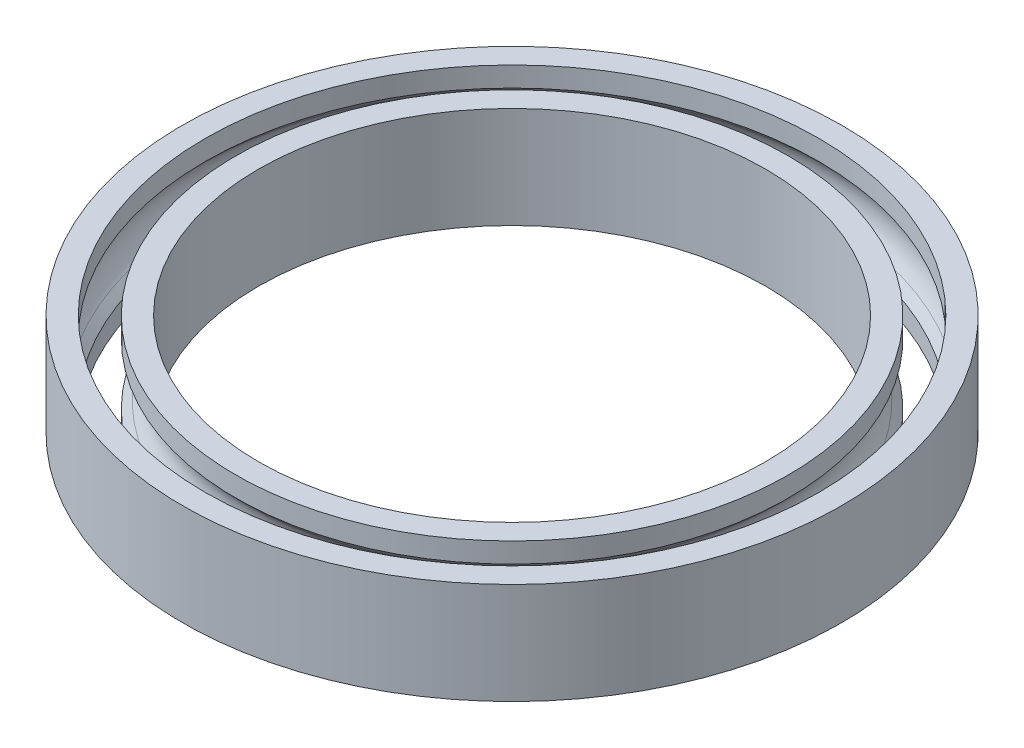
from build123d import *
from build123d.topology import SkipClean


with BuildPart() as part:
    # Sketch2 → Revolve1 (revolve)
    with BuildSketch(Plane.XY, mode=Mode.PRIVATE) as revolve1_sk:
        with BuildLine():
            Line((26.4872583, 2.2627417), (27.25, 3.0254834))
            Line((27.25, 3.0254834), (27.25, 5))
            Line((27.25, 5), (25, 5))
            Line((25, 5), (25, 0))
            Line((25, 0), (25.55, 0))
            ThreePointArc((25.55, 0), (25.793585496, 1.224586984), (26.4872583, 2.2627417))
        make_face()
        with BuildLine():
            Line((30.25, 5), (32.5, 5))
            Line((32.5, 5), (32.5, 0))
            Line((32.5, 0), (31.95, 0))
            ThreePointArc((31.95, 0), (31.706414504, 1.224586984), (31.0127417, 2.2627417))
            Line((31.0127417, 2.2627417), (30.25, 3.0254834))
            Line((30.25, 3.0254834), (30.25, 5))
        make_face()
    revolve(revolve1_sk.sketch.rotate(Axis((0, 0, 0), (0, 1, 0)), 90), axis=Axis((0, 0, 0), (0, 1, 0)))

    # Mirror1: part across plane


with BuildPart() as part_1:
    with SkipClean():  # the faces are left unmerged after this step: merging them gives an invalid solid
        add(part.part)
        add(part.part.mirror(Plane.ZX))


solid = part_1.part
